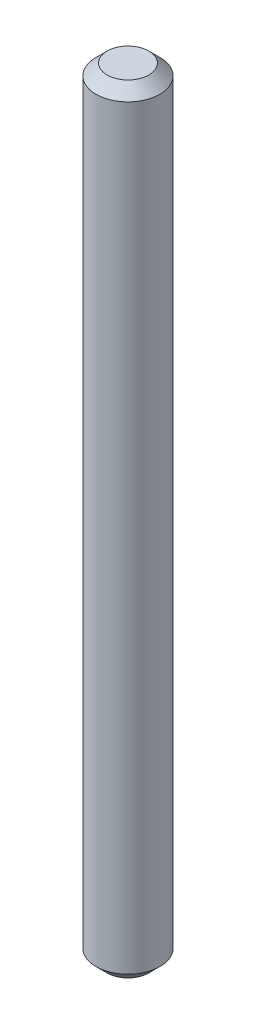
from build123d import *

# Parameters (mm, degrees)
SKETCH1_R           = 2.875
BOSS_EXTRUDE1_DEPTH = 35
CHAMFER1_SIZE       = 1


with BuildPart() as part:
    # Sketch1 → Boss-Extrude1 (new, symmetric)
    with BuildSketch(Plane(origin=(0, 0, 0), x_dir=(1, 0, 0), z_dir=(0, 1, 0))):
        with Locations(Location((0, 0, 0), (0, 0, 270))):
            Circle(SKETCH1_R)
    extrude(amount=BOSS_EXTRUDE1_DEPTH, both=True)

    # Chamfer1
    chamfer1_edges = [part.edges().sort_by_distance(p)[0] for p in [
        (0, -35, -2.875),
        (0, 35, -2.875),
    ]]
    chamfer(chamfer1_edges, length=CHAMFER1_SIZE)


solid = part.part
